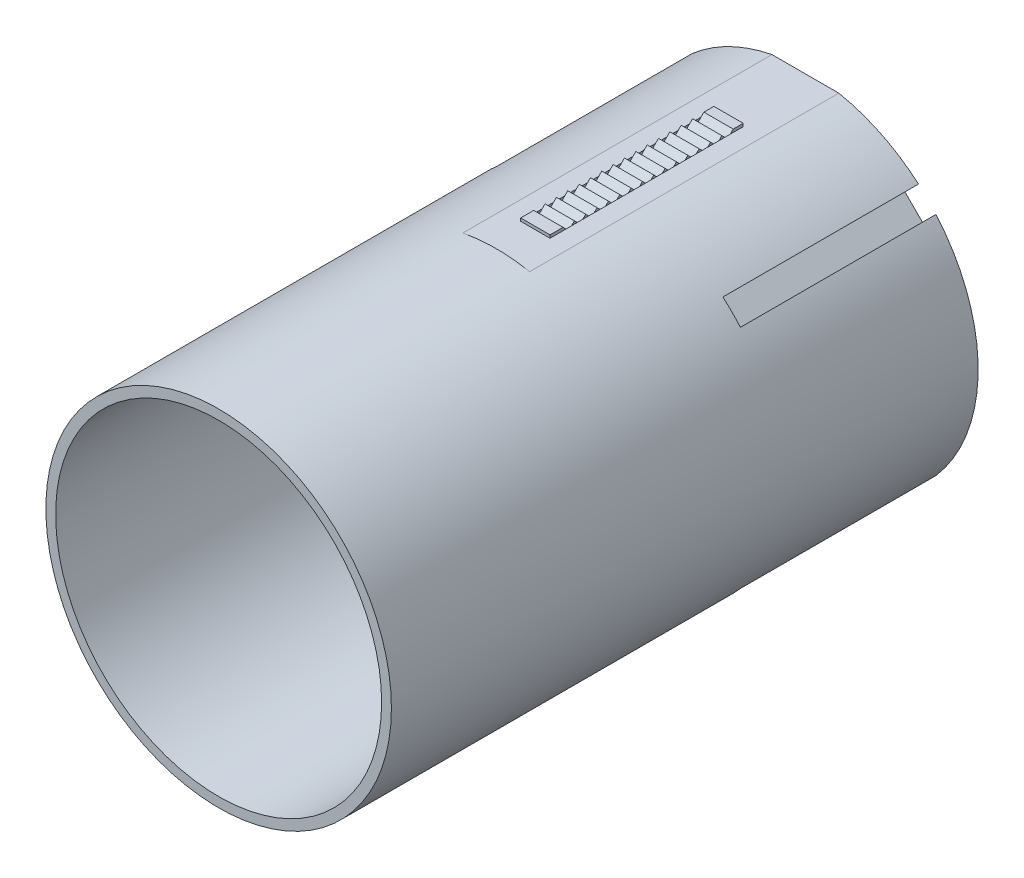
from build123d import *

# Parameters (mm, degrees)
SKIZZE1_R                            = 26.5
SKIZZE1_R_2                          = 25
AUFSATZ_LINEAR_AUSTRAGEN1_DEPTH      = 90
SCHNITT_LINEAR_AUSTRAGEN1_DEPTH      = 98.491025228
SCHNITT_LINEAR_AUSTRAGEN1_DEPTH_BACK = 98.491025228
SKIZZE2_W                            = 47.420755097
SKIZZE2_H                            = 0.5
AUFSATZ_LINEAR_AUSTRAGEN2_DEPTH      = 47.420755097
AUFSATZ_LINEAR_AUSTRAGEN3_DEPTH      = 2.25
AUFSATZ_LINEAR_AUSTRAGEN3_DEPTH_BACK = 2.25
SCHNITT_LINEAR_AUSTRAGEN2_DEPTH      = 30
AUFSATZ_LINEAR_AUSTRAGEN4_DEPTH      = 30
AUFSATZ_LINEAR_AUSTRAGEN5_DEPTH      = 1
SPIEGELN2_COPY_1_DEPTH               = 30
SPIEGELN2_COPY_2_DEPTH               = 30
SPIEGELN2_COPY_3_DEPTH               = 1
SCHNITT_LINEAR_AUSTRAGEN3_DEPTH      = 2.25
SCHNITT_LINEAR_AUSTRAGEN3_DEPTH_BACK = 2.25


with BuildPart() as part:
    # Skizze1 → Aufsatz-Linear austragen1 (new body)
    with BuildSketch(Plane.XY):
        with Locations(Location((0, 0, 0), (0, 0, 180))):
            Circle(SKIZZE1_R)
        with Locations(Location((0, 0, 0), (0, 0, 180))):
            Circle(SKIZZE1_R_2, mode=Mode.SUBTRACT)
    extrude(amount=AUFSATZ_LINEAR_AUSTRAGEN1_DEPTH)

    # Skizze2 → Schnitt-Linear austragen1 (cut, two sides: drawn at the far end of the back side and taken through both)
    with BuildSketch(Plane(origin=(0, 0, 0), x_dir=(0, 0, -1), z_dir=(1, 0, 0)).offset(-SCHNITT_LINEAR_AUSTRAGEN1_DEPTH_BACK)):
        with Locations((-23.710377549, 26.25)):
            Rectangle(SKIZZE2_W, SKIZZE2_H)
    extrude(amount=SCHNITT_LINEAR_AUSTRAGEN1_DEPTH + SCHNITT_LINEAR_AUSTRAGEN1_DEPTH_BACK, mode=Mode.SUBTRACT)

    # Skizze4 → Aufsatz-Linear austragen2 (add)
    with BuildSketch(Plane(origin=(0, 0, 0), x_dir=(-1, 0, 0), z_dir=(0, 0, -1))):
        Polygon((8.529361055, 23.5), (-8.529361055, 23.5), (-5.360314204, 25.204344352), (5.360314204, 25.204344352), align=None)
    extrude(amount=-AUFSATZ_LINEAR_AUSTRAGEN2_DEPTH)

    # Skizze5 → Aufsatz-Linear austragen3 (add, two sides: drawn at the far end of the back side and taken through both)
    with BuildSketch(Plane(origin=(0, 0, 0), x_dir=(0, 0, -1), z_dir=(1, 0, 0)).offset(-AUFSATZ_LINEAR_AUSTRAGEN3_DEPTH_BACK)):
        Polygon((-12.029982204, 26), (-11.783333845, 26), (-11.783333845, 26.449227107), (-13.320755097, 26.449227107), (-13.769982204, 26), (-12.871527991, 26), align=None)
        Polygon((-41.420755097, 26), (-38.971527991, 26), (-39.420755097, 26.449227107), (-41.420755097, 26.449227107), align=None)
        Polygon((-38.129982204, 26), (-37.231527991, 26), (-37.680755097, 26.449227107), align=None)
        Polygon((-36.389982204, 26), (-35.491527991, 26), (-35.940755097, 26.449227107), align=None)
        Polygon((-34.649982204, 26), (-33.751527991, 26), (-34.200755097, 26.449227107), align=None)
        Polygon((-32.909982204, 26), (-32.011527991, 26), (-32.460755097, 26.449227107), align=None)
        Polygon((-31.169982204, 26), (-30.271527991, 26), (-30.720755097, 26.449227107), align=None)
        Polygon((-29.429982204, 26), (-28.531527991, 26), (-28.980755097, 26.449227107), align=None)
        Polygon((-27.689982204, 26), (-26.791527991, 26), (-27.240755097, 26.449227107), align=None)
        Polygon((-25.949982204, 26), (-25.051527991, 26), (-25.500755097, 26.449227107), align=None)
        Polygon((-24.209982204, 26), (-23.311527991, 26), (-23.760755097, 26.449227107), align=None)
        Polygon((-22.469982204, 26), (-21.571527991, 26), (-22.020755097, 26.449227107), align=None)
        Polygon((-20.729982204, 26), (-19.831527991, 26), (-20.280755097, 26.449227107), align=None)
        Polygon((-18.989982204, 26), (-18.091527991, 26), (-18.540755097, 26.449227107), align=None)
        Polygon((-17.249982204, 26), (-16.351527991, 26), (-16.800755097, 26.449227107), align=None)
        Polygon((-15.509982204, 26), (-14.611527991, 26), (-15.060755097, 26.449227107), align=None)
    extrude(amount=AUFSATZ_LINEAR_AUSTRAGEN3_DEPTH + AUFSATZ_LINEAR_AUSTRAGEN3_DEPTH_BACK)

    # Skizze6 → Schnitt-Linear austragen2 (cut)
    with BuildSketch(Plane(origin=(0, 0, 0), x_dir=(-1, 0, 0), z_dir=(0, 0, -1))):
        with BuildLine():
            Line((-16.716780274, 19.403786042), (-17.346601449, 20.033607218))
            ThreePointArc((-17.346601449, 20.033607218), (-18.738329701, 18.738329701), (-20.033607218, 17.346601449))
            Line((-20.033607218, 17.346601449), (-19.403786042, 16.716780274))
            Line((-19.403786042, 16.716780274), (-18.97004537, 16.283039601))
            ThreePointArc((-18.97004537, 16.283039601), (-17.67766953, 17.67766953), (-16.283039601, 18.97004537))
            Line((-16.283039601, 18.97004537), (-16.716780274, 19.403786042))
        make_face()
        with BuildLine():
            Line((-17.346601449, 20.033607218), (-17.394826817, 20.081832586))
            Line((-17.394826817, 20.081832586), (-18.854928678, 18.854928678))
            Line((-18.854928678, 18.854928678), (-20.081832586, 17.394826817))
            Line((-20.081832586, 17.394826817), (-20.033607218, 17.346601449))
            ThreePointArc((-20.033607218, 17.346601449), (-18.738329701, 18.738329701), (-17.346601449, 20.033607218))
        make_face()
        with BuildLine():
            Line((-15.273506474, 17.960512242), (-16.283039601, 18.97004537))
            ThreePointArc((-16.283039601, 18.97004537), (-17.67766953, 17.67766953), (-18.97004537, 16.283039601))
            Line((-18.97004537, 16.283039601), (-17.960512242, 15.273506474))
            Line((-17.960512242, 15.273506474), (-15.273506474, 17.960512242))
        make_face()
    schnitt_linear_austragen2 = extrude(amount=-SCHNITT_LINEAR_AUSTRAGEN2_DEPTH, mode=Mode.SUBTRACT)

    # Skizze6<3> → Aufsatz-Linear austragen4 (add)
    with BuildSketch(Plane(origin=(0, 0, 0), x_dir=(-1, 0, 0), z_dir=(0, 0, -1))):
        with BuildLine():
            ThreePointArc((-15.109260367, 19.917586479), (-15.703298471, 19.452671208), (-16.283039601, 18.97004537))
            Line((-16.283039601, 18.97004537), (-15.273506474, 17.960512242))
            Line((-15.273506474, 17.960512242), (-17.960512242, 15.273506474))
            Line((-17.960512242, 15.273506474), (-18.97004537, 16.283039601))
            ThreePointArc((-18.97004537, 16.283039601), (-19.452671208, 15.703298471), (-19.917586479, 15.109260367))
            Line((-19.917586479, 15.109260367), (-17.960512242, 13.15218613))
            Line((-17.960512242, 13.15218613), (-13.15218613, 17.960512242))
            Line((-13.15218613, 17.960512242), (-15.109260367, 19.917586479))
        make_face()
    aufsatz_linear_austragen4 = extrude(amount=-AUFSATZ_LINEAR_AUSTRAGEN4_DEPTH)

    # Skizze7 → Aufsatz-Linear austragen5 (add)
    with BuildSketch(Plane.XY.offset(30)):
        Polygon((13.15218613, 17.960512242), (17.960512242, 13.15218613), (19.917586479, 15.109260367), (18.25472482, 18.000193095), (15.352274142, 20.160600254), align=None)
    aufsatz_linear_austragen5 = extrude(amount=AUFSATZ_LINEAR_AUSTRAGEN5_DEPTH)

    # Spiegeln1: Schnitt-Linear austragen2, Aufsatz-Linear austragen4, Aufsatz-Linear austragen5 across plane
    add(schnitt_linear_austragen2.mirror(Plane(origin=(0, 0, 0), x_dir=(0, 0, 1), z_dir=(1, 0, 0))), mode=Mode.SUBTRACT)
    add(aufsatz_linear_austragen4.mirror(Plane(origin=(0, 0, 0), x_dir=(0, 0, 1), z_dir=(1, 0, 0))))
    add(aufsatz_linear_austragen5.mirror(Plane(origin=(0, 0, 0), x_dir=(0, 0, 1), z_dir=(1, 0, 0))))

    # Spiegeln2: Schnitt-Linear austragen2, Aufsatz-Linear austragen4, Aufsatz-Linear austragen5 across plane
    add(schnitt_linear_austragen2.mirror(Plane.ZX), mode=Mode.SUBTRACT)
    add(aufsatz_linear_austragen4.mirror(Plane.ZX))
    add(aufsatz_linear_austragen5.mirror(Plane.ZX))

    # Spiegeln2 copy 1 sketch → Spiegeln2 copy 1 (cut)
    with BuildSketch(Plane(origin=(0, 0, 0), x_dir=(1, 0, 0), z_dir=(0, 0, -1))):
        with BuildLine():
            Line((-16.716780274, 19.403786042), (-17.346601449, 20.033607218))
            ThreePointArc((-17.346601449, 20.033607218), (-18.738329701, 18.738329701), (-20.033607218, 17.346601449))
            Line((-20.033607218, 17.346601449), (-19.403786042, 16.716780274))
            Line((-19.403786042, 16.716780274), (-18.97004537, 16.283039601))
            ThreePointArc((-18.97004537, 16.283039601), (-17.67766953, 17.67766953), (-16.283039601, 18.97004537))
            Line((-16.283039601, 18.97004537), (-16.716780274, 19.403786042))
        make_face()
        with BuildLine():
            Line((-17.346601449, 20.033607218), (-17.394826817, 20.081832586))
            Line((-17.394826817, 20.081832586), (-18.854928678, 18.854928678))
            Line((-18.854928678, 18.854928678), (-20.081832586, 17.394826817))
            Line((-20.081832586, 17.394826817), (-20.033607218, 17.346601449))
            ThreePointArc((-20.033607218, 17.346601449), (-18.738329701, 18.738329701), (-17.346601449, 20.033607218))
        make_face()
        with BuildLine():
            Line((-15.273506474, 17.960512242), (-16.283039601, 18.97004537))
            ThreePointArc((-16.283039601, 18.97004537), (-17.67766953, 17.67766953), (-18.97004537, 16.283039601))
            Line((-18.97004537, 16.283039601), (-17.960512242, 15.273506474))
            Line((-17.960512242, 15.273506474), (-15.273506474, 17.960512242))
        make_face()
    extrude(amount=-SPIEGELN2_COPY_1_DEPTH, mode=Mode.SUBTRACT)

    # Spiegeln2 copy 2 sketch → Spiegeln2 copy 2 (add)
    with BuildSketch(Plane(origin=(0, 0, 0), x_dir=(1, 0, 0), z_dir=(0, 0, -1))):
        with BuildLine():
            ThreePointArc((-15.109260367, 19.917586479), (-15.703298471, 19.452671208), (-16.283039601, 18.97004537))
            Line((-16.283039601, 18.97004537), (-15.273506474, 17.960512242))
            Line((-15.273506474, 17.960512242), (-17.960512242, 15.273506474))
            Line((-17.960512242, 15.273506474), (-18.97004537, 16.283039601))
            ThreePointArc((-18.97004537, 16.283039601), (-19.452671208, 15.703298471), (-19.917586479, 15.109260367))
            Line((-19.917586479, 15.109260367), (-17.960512242, 13.15218613))
            Line((-17.960512242, 13.15218613), (-13.15218613, 17.960512242))
            Line((-13.15218613, 17.960512242), (-15.109260367, 19.917586479))
        make_face()
    extrude(amount=-SPIEGELN2_COPY_2_DEPTH)

    # Spiegeln2 copy 3 sketch → Spiegeln2 copy 3 (add)
    with BuildSketch(Plane(origin=(0, 0, 30), x_dir=(-1, 0, 0), z_dir=(0, 0, 1))):
        Polygon((13.15218613, 17.960512242), (17.960512242, 13.15218613), (19.917586479, 15.109260367), (18.25472482, 18.000193095), (15.352274142, 20.160600254), align=None)
    extrude(amount=SPIEGELN2_COPY_3_DEPTH)

    # Skizze5<3> → Schnitt-Linear austragen3 (cut, two sides: drawn at the far end of the back side and taken through both)
    with BuildSketch(Plane(origin=(0, 0, 0), x_dir=(0, 0, -1), z_dir=(1, 0, 0)).offset(-SCHNITT_LINEAR_AUSTRAGEN3_DEPTH_BACK)):
        Polygon((-38.550755097, 25.579227107), (-38.129982204, 26), (-38.971527991, 26), align=None)
        Polygon((-36.810755097, 25.579227107), (-36.389982204, 26), (-37.231527991, 26), align=None)
        Polygon((-35.070755097, 25.579227107), (-34.649982204, 26), (-35.491527991, 26), align=None)
        Polygon((-33.330755097, 25.579227107), (-32.909982204, 26), (-33.751527991, 26), align=None)
        Polygon((-31.590755097, 25.579227107), (-31.169982204, 26), (-32.011527991, 26), align=None)
        Polygon((-29.850755097, 25.579227107), (-29.429982204, 26), (-30.271527991, 26), align=None)
        Polygon((-28.110755097, 25.579227107), (-27.689982204, 26), (-28.531527991, 26), align=None)
        Polygon((-26.370755097, 25.579227107), (-25.949982204, 26), (-26.791527991, 26), align=None)
        Polygon((-24.630755097, 25.579227107), (-24.209982204, 26), (-25.051527991, 26), align=None)
        Polygon((-22.890755097, 25.579227107), (-22.469982204, 26), (-23.311527991, 26), align=None)
        Polygon((-21.150755097, 25.579227107), (-20.729982204, 26), (-21.571527991, 26), align=None)
        Polygon((-19.385368651, 25.604613553), (-18.989982204, 26), (-19.831527991, 26), (-19.410755097, 25.579227107), align=None)
        Polygon((-17.645368651, 25.604613553), (-17.249982204, 26), (-18.091527991, 26), (-17.696141544, 25.604613553), (-17.670755097, 25.579227107), align=None)
        Polygon((-15.535368651, 25.974613553), (-15.509982204, 26), (-16.351527991, 26), (-16.326141544, 25.974613553), (-15.930755097, 25.579227107), align=None)
        Polygon((-13.795368651, 25.974613553), (-13.769982204, 26), (-14.611527991, 26), (-14.586141544, 25.974613553), (-14.190755097, 25.579227107), align=None)
    extrude(amount=SCHNITT_LINEAR_AUSTRAGEN3_DEPTH + SCHNITT_LINEAR_AUSTRAGEN3_DEPTH_BACK, mode=Mode.SUBTRACT)


solid = part.part
